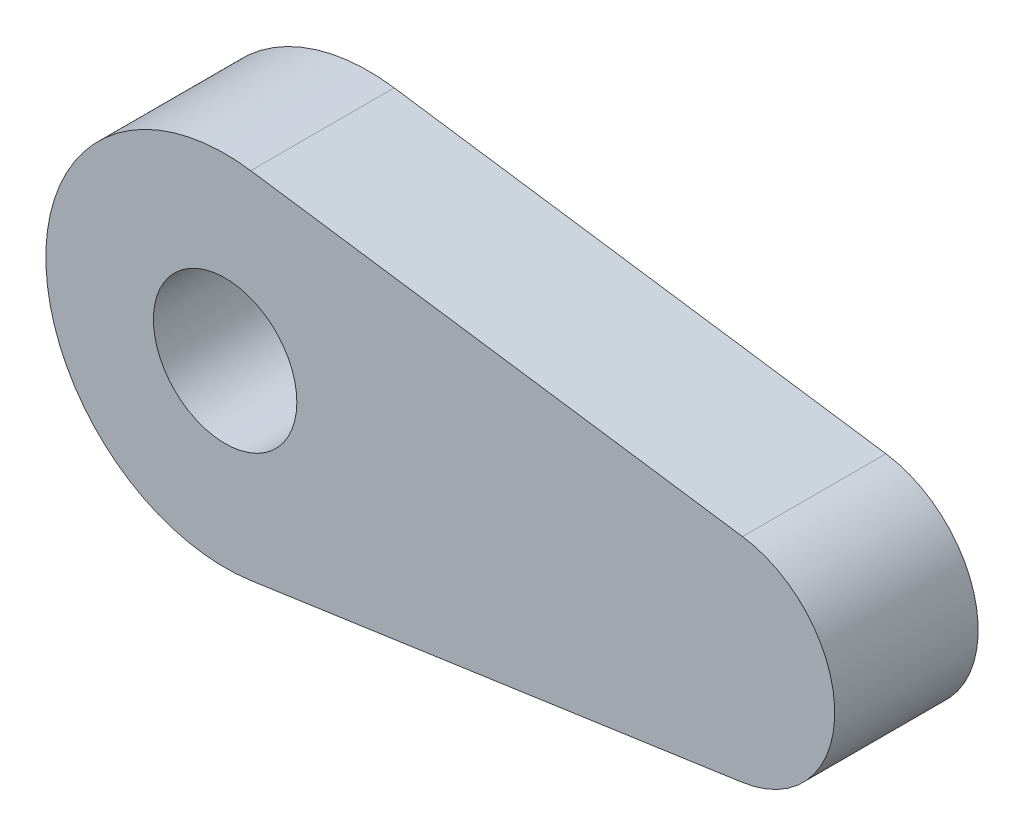
from build123d import *

# Parameters (mm, degrees)
SKETCH_1_R      = 1
EXTRUDE_1_DEPTH = 2


with BuildPart() as part:
    # 草图1 → 凸台-拉伸1 (new body)
    with BuildSketch(Plane.XY):
        with BuildLine():
            Line((-21.519832045, 3.459542049), (-14.662689188, 2.46979873))
            ThreePointArc((-14.662689188, 2.46979873), (-13.376974902, 0.985183752), (-14.662689188, -0.499431226))
            Line((-14.662689188, -0.499431226), (-21.519832045, -1.489174544))
            ThreePointArc((-21.519832045, -1.489174544), (-24.376974902, 0.985183752), (-21.519832045, 3.459542049))
        make_face()
        with Locations((-21.876974902, 0.985183752)):
            Circle(SKETCH_1_R, mode=Mode.SUBTRACT)
    extrude(amount=EXTRUDE_1_DEPTH)


solid = part.part
